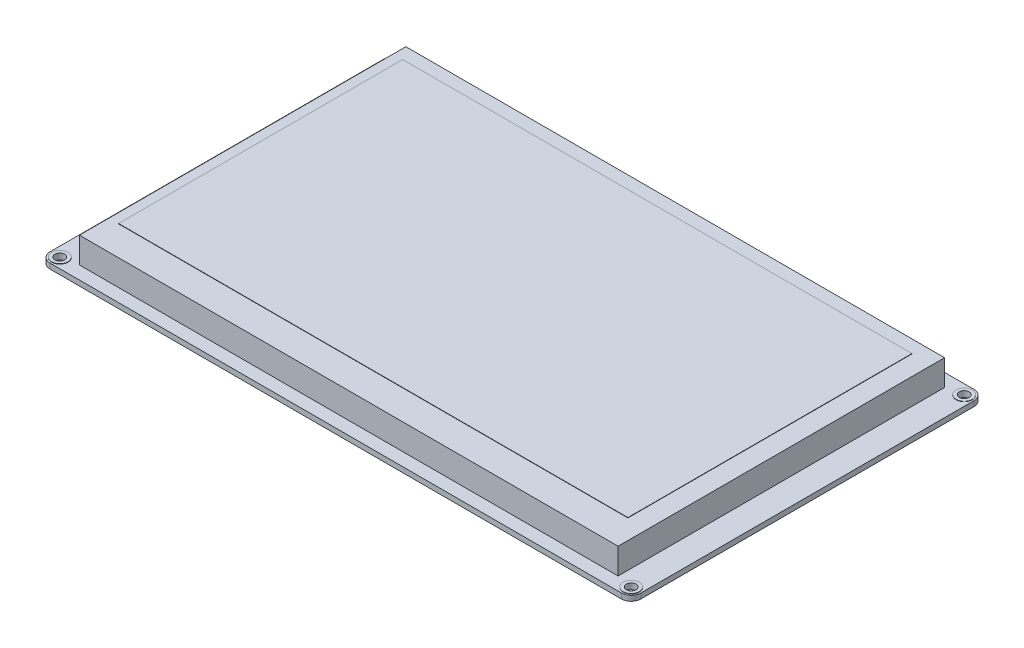
from build123d import *

# Parameters (mm, degrees)
BOSS_EXTRUDE1_DEPTH = 0.8
SKETCH2_R           = 1.5
CUT_EXTRUDE1_DEPTH  = 106.398339645
BOSS_EXTRUDE2_START = 0.1
SKETCH3_R           = 2.5
SKETCH3_R_2         = 1.5
BOSS_EXTRUDE2_DEPTH = 0.1
SKETCH4_W           = 165
SKETCH4_H           = 100
BOSS_EXTRUDE3_DEPTH = 8
SKETCH5_OUTSIDE_W   = 225.2
SKETCH5_OUTSIDE_H   = 152.2
SKETCH5_OUTSIDE_W_2 = 156
SKETCH5_OUTSIDE_H_2 = 87
CUT_EXTRUDE2_DEPTH  = 0.1
SKETCH6_W           = 8
SKETCH6_H           = 15
BOSS_EXTRUDE4_DEPTH = 6
SHELL1_T            = -1


with BuildPart() as part:
    # Sketch1 → Boss-Extrude1 (new, symmetric)
    with BuildSketch(Plane(origin=(0, 0, 0), x_dir=(1, 0, 0), z_dir=(0, 1, 0))):
        with BuildLine():
            Line((-87.5, -54), (87.5, -54))
            ThreePointArc((87.5, -54), (89.621320344, -53.121320344), (90.5, -51))
            Line((90.5, -51), (90.5, 51))
            ThreePointArc((90.5, 51), (89.621320344, 53.121320344), (87.5, 54))
            Line((87.5, 54), (-87.5, 54))
            ThreePointArc((-87.5, 54), (-89.621320344, 53.121320344), (-90.5, 51))
            Line((-90.5, 51), (-90.5, -51))
            ThreePointArc((-90.5, -51), (-89.621320344, -53.121320344), (-87.5, -54))
        make_face()
    extrude(amount=BOSS_EXTRUDE1_DEPTH, both=True)

    # Sketch2 → Cut-Extrude1 (cut, through all)
    with BuildSketch(Plane(origin=(0, 0.8, 0), x_dir=(1, 0, 0), z_dir=(0, 1, 0))):
        with Locations(Location((-87.5, 51, 0), (0, 0, 270))):
            Circle(SKETCH2_R)
        with Locations(Location((-87.5, -51, 0), (0, 0, 270))):
            Circle(SKETCH2_R)
        with Locations(Location((87.5, -51, 0), (0, 0, 270))):
            Circle(SKETCH2_R)
        with Locations(Location((87.5, 51, 0), (0, 0, 270))):
            Circle(SKETCH2_R)
    extrude(amount=-CUT_EXTRUDE1_DEPTH, mode=Mode.SUBTRACT)

    # Sketch3 → Boss-Extrude2 (add)
    # profile 1 of 4: a face of its own
    with BuildSketch(Plane(origin=(0, 0.8, 0), x_dir=(1, 0, 0), z_dir=(0, 1, 0)).offset(BOSS_EXTRUDE2_START)):
        with Locations(Location((-87.5, 51, 0), (0, 0, 90))):
            Circle(SKETCH3_R)
        with Locations(Location((-87.5, 51, 0), (0, 0, 270))):
            Circle(SKETCH3_R_2, mode=Mode.SUBTRACT)
    # profile 2 of 4: a face of its own
    with BuildSketch(Plane(origin=(0, 0.8, 0), x_dir=(1, 0, 0), z_dir=(0, 1, 0)).offset(BOSS_EXTRUDE2_START)):
        with Locations(Location((87.5, 51, 0), (0, 0, 90))):
            Circle(SKETCH3_R)
        with Locations(Location((87.5, 51, 0), (0, 0, 270))):
            Circle(SKETCH3_R_2, mode=Mode.SUBTRACT)
    # profile 3 of 4: a face of its own
    with BuildSketch(Plane(origin=(0, 0.8, 0), x_dir=(1, 0, 0), z_dir=(0, 1, 0)).offset(BOSS_EXTRUDE2_START)):
        with Locations(Location((87.5, -51, 0), (0, 0, 90))):
            Circle(SKETCH3_R)
        with Locations(Location((87.5, -51, 0), (0, 0, 270))):
            Circle(SKETCH3_R_2, mode=Mode.SUBTRACT)
    # profile 4 of 4: a face of its own
    with BuildSketch(Plane(origin=(0, 0.8, 0), x_dir=(1, 0, 0), z_dir=(0, 1, 0)).offset(BOSS_EXTRUDE2_START)):
        with Locations(Location((-87.5, -51, 0), (0, 0, 90))):
            Circle(SKETCH3_R)
        with Locations(Location((-87.5, -51, 0), (0, 0, 270))):
            Circle(SKETCH3_R_2, mode=Mode.SUBTRACT)
    boss_extrude2 = extrude(amount=-BOSS_EXTRUDE2_DEPTH)

    # Mirror1: Boss-Extrude2 across plane
    add(boss_extrude2.mirror(Plane.ZX))


with BuildPart() as body_2:
    # Sketch4 → Boss-Extrude3 (new body)
    with BuildSketch(Plane(origin=(0, 0.8, 0), x_dir=(1, 0, 0), z_dir=(0, 1, 0))):
        Rectangle(SKETCH4_W, SKETCH4_H)
    extrude(amount=BOSS_EXTRUDE3_DEPTH)

    # Sketch5 outside → Cut-Extrude2 (cut)
    with BuildSketch(Plane(origin=(0, 8.8, 0), x_dir=(1, 0, 0), z_dir=(0, 1, 0))):
        Rectangle(SKETCH5_OUTSIDE_W, SKETCH5_OUTSIDE_H)
        with Locations((-1.5, 2.5)):
            Rectangle(SKETCH5_OUTSIDE_W_2, SKETCH5_OUTSIDE_H_2, mode=Mode.SUBTRACT)
    extrude(amount=-CUT_EXTRUDE2_DEPTH, mode=Mode.SUBTRACT)


with BuildPart() as body_3:
    # Sketch6 → Boss-Extrude4 (new body)
    with BuildSketch(Plane.XZ.offset(0.8)):
        with Locations((-86.5, 0)):
            Rectangle(SKETCH6_W, SKETCH6_H)
    extrude(amount=BOSS_EXTRUDE4_DEPTH)

    # Shell1
    shell1_openings = [body_3.faces().sort_by_distance(p)[0] for p in [
        (-90.5, -3.8, 0),
    ]]
    offset(amount=SHELL1_T, openings=shell1_openings, kind=Kind.INTERSECTION)


solid = Compound([part.part, body_2.part, body_3.part])
